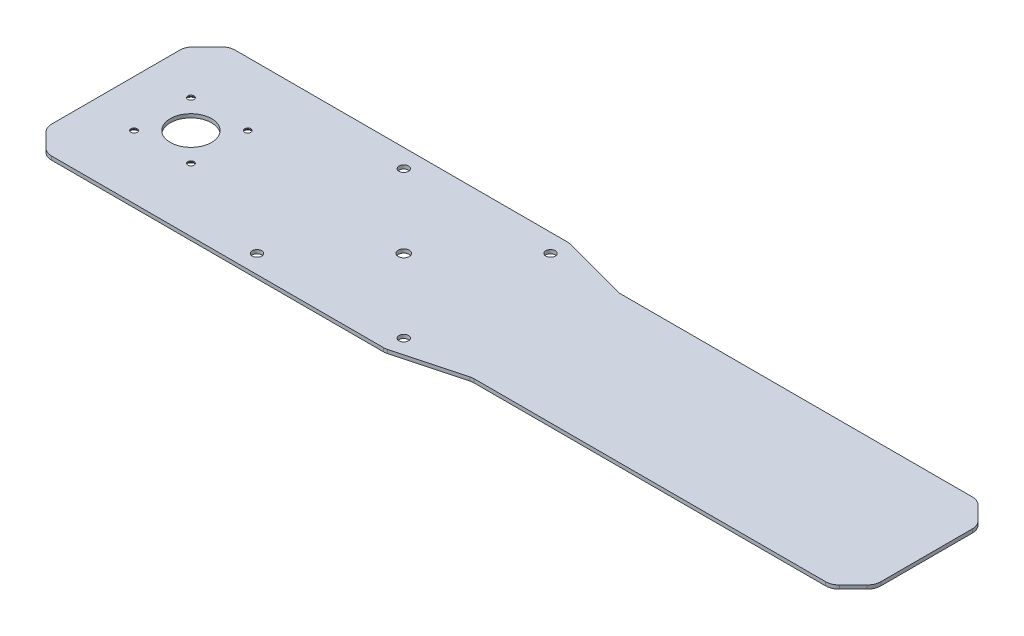
from build123d import *

# Parameters (mm, degrees)
BOSS_EXTRUDE2_DEPTH                          = 2
CHAMFER2_SIZE                                = 12
FILLET1_R                                    = 7.5
SKETCH2_R                                    = 2.575
SKETCH2_R_2                                  = 11.25
SKETCH2_R_3                                  = 3
CUT_EXTRUDE1_DEPTH                           = 290.359637821
CSK_FOR_M3_COUNTERSUNK_FLAT_HEAD_SCR_2_COUNT = 2
CSK_FOR_M3_COUNTERSUNK_FLAT_HEAD_SCR_2_PITCH = 31
CSK_FOR_M3_COUNTERSUNK_FLAT_HEAD_SCR_3_COUNT = 2
CSK_FOR_M3_COUNTERSUNK_FLAT_HEAD_SCR_3_PITCH = 43.840620434
CSK_FOR_M3_COUNTERSUNK_FLAT_HEAD_SCR_4_COUNT = 2
CSK_FOR_M3_COUNTERSUNK_FLAT_HEAD_SCR_4_PITCH = 31


with BuildPart() as part:
    # Sketch1 → Boss-Extrude2 (new body)
    with BuildSketch(Plane(origin=(0, 0, 0), x_dir=(1, 0, 0), z_dir=(0, 1, 0))):
        Polygon((40, -50), (77.320508076, -40), (285, -40), (285, 40), (77.320508076, 40), (40, 50), (-40, 50), (-157, 50), (-157, -50), (-40, -50), align=None)
    extrude(amount=BOSS_EXTRUDE2_DEPTH)

    # Chamfer2
    chamfer2_edges = [part.edges().sort_by_distance(p)[0] for p in [
        (-157, 1, 50),
        (-157, 1, -50),
        (285, 1, -40),
        (285, 1, 40),
    ]]
    chamfer(chamfer2_edges, length=CHAMFER2_SIZE)

    # Fillet1
    fillet1_edges = [part.edges().sort_by_distance(p)[0] for p in [
        (40, 1, -50),
        (77.320508076, 1, -40),
        (77.320508076, 1, 40),
        (40, 1, 50),
        (-145, 1, 50),
        (-157, 1, -38),
        (-157, 1, 38),
        (-145, 1, -50),
        (273, 1, -40),
        (285, 1, 28),
        (285, 1, -28),
        (273, 1, 40),
    ]]
    fillet(fillet1_edges, radius=FILLET1_R)

    # Sketch2 → Cut-Extrude1 (cut, through all)
    with BuildSketch(Plane(origin=(0, 2, 0), x_dir=(1, 0, 0), z_dir=(0, 1, 0))):
        with Locations(Location((-40, 40, 0), (0, 0, 270))):
            Circle(SKETCH2_R)
        with Locations(Location((40, 40, 0), (0, 0, 90))):
            Circle(SKETCH2_R)
        with Locations(Location((40, -40, 0), (0, 0, 270))):
            Circle(SKETCH2_R)
        with Locations(Location((-40, -40, 0), (0, 0, 90))):
            Circle(SKETCH2_R)
        with Locations(Location((-116, 0, 0), (0, 0, 270))):
            Circle(SKETCH2_R_2)
        with Locations(Location((0, 0, 0), (0, 0, 270))):
            Circle(SKETCH2_R_3)
    extrude(amount=-CUT_EXTRUDE1_DEPTH, mode=Mode.SUBTRACT)

    # Sketch4 → CSK for M3 Countersunk Flat Head Screw2 (revolve, cut)
    with BuildSketch(Plane(origin=(-131.5, 0, -15.5), x_dir=(0, 0, -1), z_dir=(1, 0, 0))):
        Polygon((0, 0), (0, 2), (1.7, 2), (1.7, 1.45), (3.15, 0), align=None)
    csk_for_m3_countersunk_flat_head_screw2 = revolve(axis=Axis((-131.5, -6.35, -15.5), (0, 1, 0)), mode=Mode.SUBTRACT)

    # CSK for M3 Countersunk Flat Head Scr 2: CSK for M3 Countersunk Flat Head Screw2 ×2
    with Locations(*[(0, 0, i * CSK_FOR_M3_COUNTERSUNK_FLAT_HEAD_SCR_2_PITCH) for i in range(1, CSK_FOR_M3_COUNTERSUNK_FLAT_HEAD_SCR_2_COUNT)]):
        add(csk_for_m3_countersunk_flat_head_screw2, mode=Mode.SUBTRACT)

    # CSK for M3 Countersunk Flat Head Scr 3: CSK for M3 Countersunk Flat Head Screw2 ×2
    with Locations(*[Vector(0.707106781186545, 0, 0.70710678118655) * (i * CSK_FOR_M3_COUNTERSUNK_FLAT_HEAD_SCR_3_PITCH) for i in range(1, CSK_FOR_M3_COUNTERSUNK_FLAT_HEAD_SCR_3_COUNT)]):
        add(csk_for_m3_countersunk_flat_head_screw2, mode=Mode.SUBTRACT)

    # CSK for M3 Countersunk Flat Head Scr 4: CSK for M3 Countersunk Flat Head Screw2 ×2
    with Locations(*[(i * CSK_FOR_M3_COUNTERSUNK_FLAT_HEAD_SCR_4_PITCH, 0, 0) for i in range(1, CSK_FOR_M3_COUNTERSUNK_FLAT_HEAD_SCR_4_COUNT)]):
        add(csk_for_m3_countersunk_flat_head_screw2, mode=Mode.SUBTRACT)


solid = part.part
